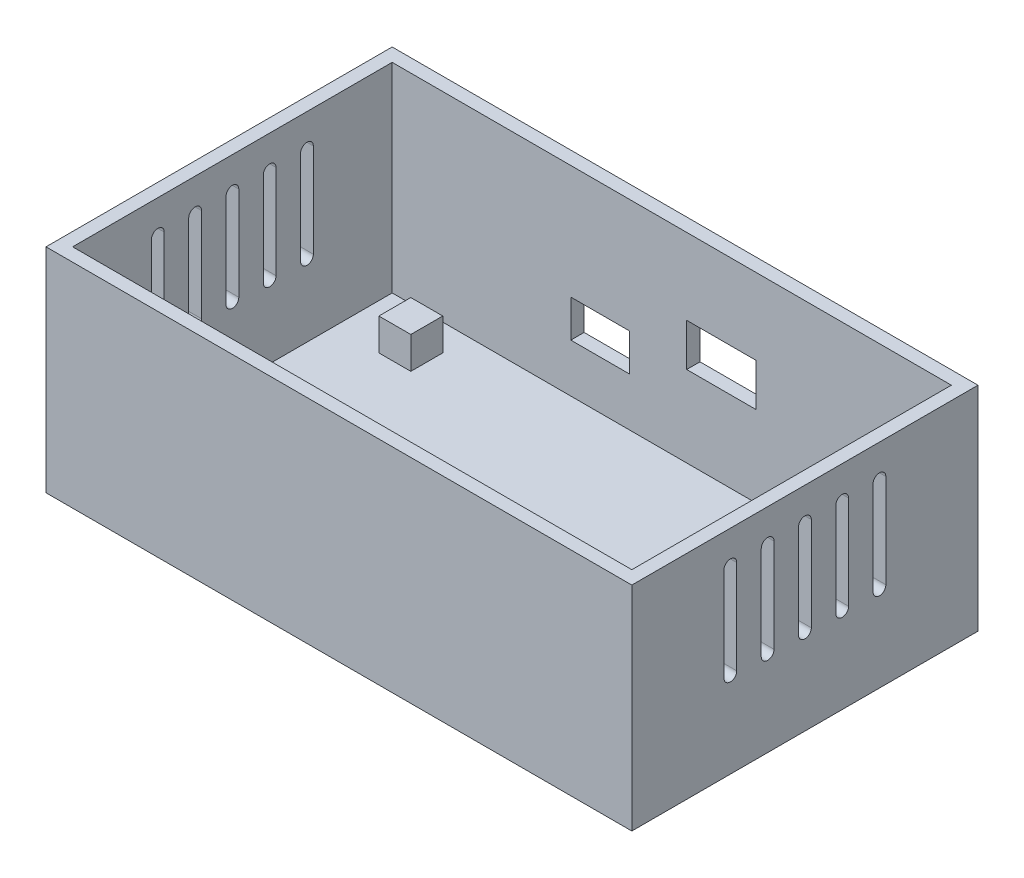
from build123d import *

# Parameters (mm, degrees)
CROQUIS_CONTORNO_W            = 110
CROQUIS_CONTORNO_H            = 65
CUERPO_DEPTH                  = 40
CROQUIS_VACIADO_W             = 105
CROQUIS_VACIADO_H             = 60
VACIADO_DEPTH                 = 37.5
CROQUIS_APOYOS_PCB_W          = 6
CROQUIS_APOYOS_PCB_H          = 6
APOYOS_PCB_DEPTH              = 6
CROQUIS_SALIDAS_W             = 13
CROQUIS_SALIDAS_H             = 8
CROQUIS_SALIDAS_W_2           = 11
CROQUIS_SALIDAS_H_2           = 7
SALIDAS_USB_Y_PANEL_DEPTH     = 76.374067158
VENTILAS_LATERALES_DEPTH      = 76.374067158
VENTILAS_LATERALES_DEPTH_BACK = 76.374067158
AGUJEROS_M3_DEPTH             = 76.374067158
AGUJEROS_M3_DEPTH_BACK        = 76.374067158
CROQUIS_TORNILLOS_R           = 1.7


with BuildPart() as part:
    # Croquis_contorno → Cuerpo (new body)
    with BuildSketch(Plane(origin=(0, 0, 0), x_dir=(1, 0, 0), z_dir=(0, 1, 0))):
        Rectangle(CROQUIS_CONTORNO_W, CROQUIS_CONTORNO_H)
    extrude(amount=CUERPO_DEPTH)

    # Croquis_vaciado → Vaciado (cut)
    with BuildSketch(Plane(origin=(0, 40, 0), x_dir=(1, 0, 0), z_dir=(0, 1, 0))):
        Rectangle(CROQUIS_VACIADO_W, CROQUIS_VACIADO_H)
    extrude(amount=-VACIADO_DEPTH, mode=Mode.SUBTRACT)

    # Croquis_apoyos_pcb → Apoyos_PCB (add)
    with BuildSketch(Plane(origin=(0, 2.5, 0), x_dir=(1, 0, 0), z_dir=(0, 1, 0))):
        with Locations((-41, 22)):
            Rectangle(CROQUIS_APOYOS_PCB_W, CROQUIS_APOYOS_PCB_H)
        with Locations((-41, -22)):
            Rectangle(CROQUIS_APOYOS_PCB_W, CROQUIS_APOYOS_PCB_H)
        with Locations((41, 22)):
            Rectangle(CROQUIS_APOYOS_PCB_W, CROQUIS_APOYOS_PCB_H)
        with Locations((41, -22)):
            Rectangle(CROQUIS_APOYOS_PCB_W, CROQUIS_APOYOS_PCB_H)
    extrude(amount=APOYOS_PCB_DEPTH)

    # Croquis_salidas → Salidas_USB_y_panel (cut, through all)
    with BuildSketch(Plane.XY):
        with Locations((9.3, 21.7)):
            Rectangle(CROQUIS_SALIDAS_W, CROQUIS_SALIDAS_H)
        with Locations((-13.46, 15.1)):
            Rectangle(CROQUIS_SALIDAS_W_2, CROQUIS_SALIDAS_H_2)
    extrude(amount=-SALIDAS_USB_Y_PANEL_DEPTH, mode=Mode.SUBTRACT)

    # Croquis_ventilas → Ventilas_laterales (cut, two sides: drawn at the far end of the back side and taken through both)
    with BuildSketch(Plane(origin=(0, 0, 0), x_dir=(0, 0, -1), z_dir=(1, 0, 0)).offset(-VENTILAS_LATERALES_DEPTH_BACK)):
        with BuildLine():
            Line((-15.2, 16.2), (-15.2, 33.8))
            ThreePointArc((-15.2, 33.8), (-14, 35), (-12.8, 33.8))
            Line((-12.8, 33.8), (-12.8, 16.2))
            ThreePointArc((-12.8, 16.2), (-14, 15), (-15.2, 16.2))
        make_face()
        with BuildLine():
            Line((-8.2, 16.2), (-8.2, 33.8))
            ThreePointArc((-8.2, 33.8), (-7, 35), (-5.8, 33.8))
            Line((-5.8, 33.8), (-5.8, 16.2))
            ThreePointArc((-5.8, 16.2), (-7, 15), (-8.2, 16.2))
        make_face()
        with BuildLine():
            Line((-1.2, 16.2), (-1.2, 33.8))
            ThreePointArc((-1.2, 33.8), (0, 35), (1.2, 33.8))
            Line((1.2, 33.8), (1.2, 16.2))
            ThreePointArc((1.2, 16.2), (0, 15), (-1.2, 16.2))
        make_face()
        with BuildLine():
            Line((5.8, 16.2), (5.8, 33.8))
            ThreePointArc((5.8, 33.8), (7, 35), (8.2, 33.8))
            Line((8.2, 33.8), (8.2, 16.2))
            ThreePointArc((8.2, 16.2), (7, 15), (5.8, 16.2))
        make_face()
        with BuildLine():
            Line((12.8, 16.2), (12.8, 33.8))
            ThreePointArc((12.8, 33.8), (14, 35), (15.2, 33.8))
            Line((15.2, 33.8), (15.2, 16.2))
            ThreePointArc((15.2, 16.2), (14, 15), (12.8, 16.2))
        make_face()
    extrude(amount=VENTILAS_LATERALES_DEPTH + VENTILAS_LATERALES_DEPTH_BACK, mode=Mode.SUBTRACT)

    # Croquis_tornillos → Agujeros_M3 (cut, two sides: drawn at the far end of the back side and taken through both)
    with BuildSketch(Plane(origin=(0, 0, 0), x_dir=(1, 0, 0), z_dir=(0, 1, 0)).offset(-AGUJEROS_M3_DEPTH_BACK)):
        with Locations(Location((-30, 0, 0), (0, 0, 90))):
            Circle(CROQUIS_TORNILLOS_R)
        with Locations(Location((30, 0, 0), (0, 0, 90))):
            Circle(CROQUIS_TORNILLOS_R)
    extrude(amount=AGUJEROS_M3_DEPTH + AGUJEROS_M3_DEPTH_BACK, mode=Mode.SUBTRACT)


solid = part.part
